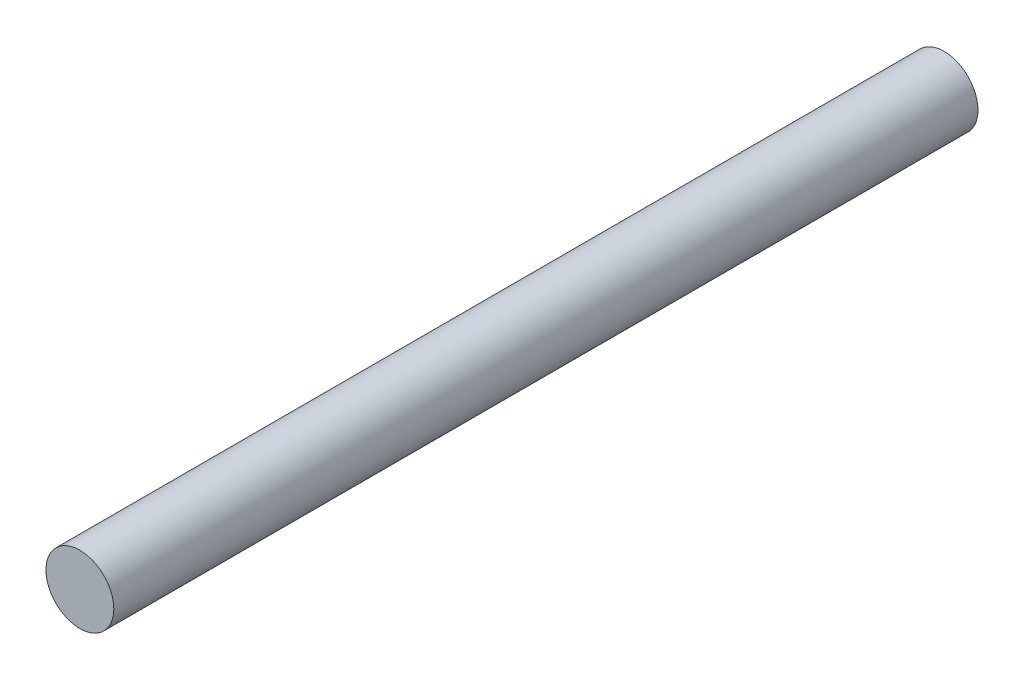
from build123d import *

# Parameters (mm, degrees)
BOSS_EXTRUDE1_DEPTH      = 173.2
BOSS_EXTRUDE1_DEPTH_BACK = 53.2
SKETCH1_R                = 8.89


with BuildPart() as part:
    # Sketch1 → Boss-Extrude1 (new, two sides: drawn at the far end of the back side and taken through both)
    with BuildSketch(Plane.XY.offset(-BOSS_EXTRUDE1_DEPTH_BACK)):
        Circle(SKETCH1_R)
    extrude(amount=BOSS_EXTRUDE1_DEPTH + BOSS_EXTRUDE1_DEPTH_BACK)


solid = part.part
